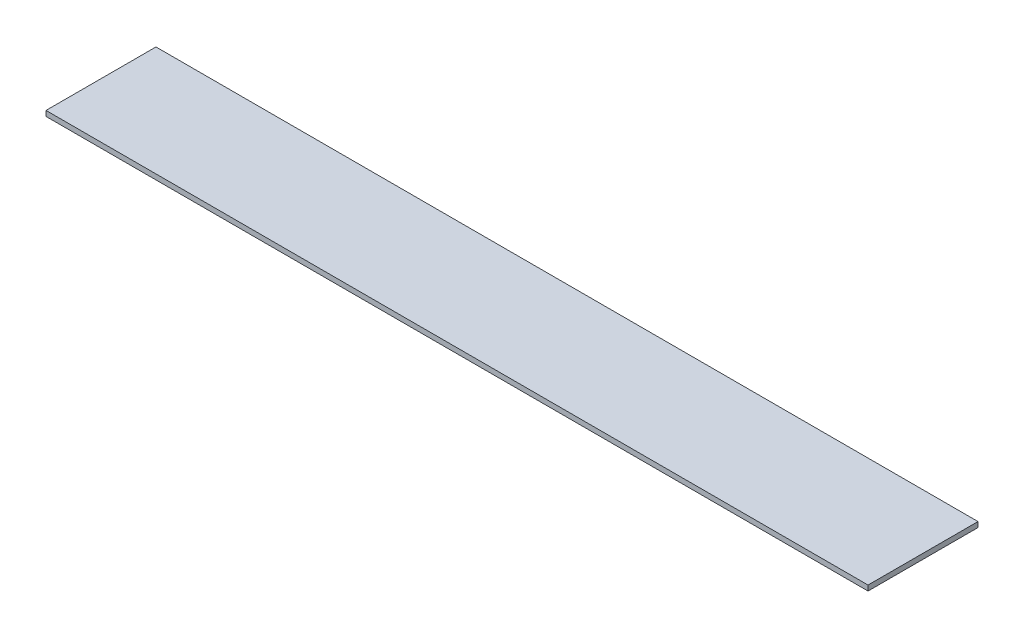
from build123d import *

# Parameters (mm, degrees)
SKETCH_1_W      = 157
SKETCH_1_H      = 21
EXTRUDE_1_DEPTH = 1


with BuildPart() as part:
    # 草图1 → 凸台-拉伸1 (new body)
    with BuildSketch(Plane(origin=(0, 0, 0), x_dir=(1, 0, 0), z_dir=(0, 1, 0))):
        with Locations((-78.5, 10.5)):
            Rectangle(SKETCH_1_W, SKETCH_1_H)
    extrude(amount=EXTRUDE_1_DEPTH)


solid = part.part
